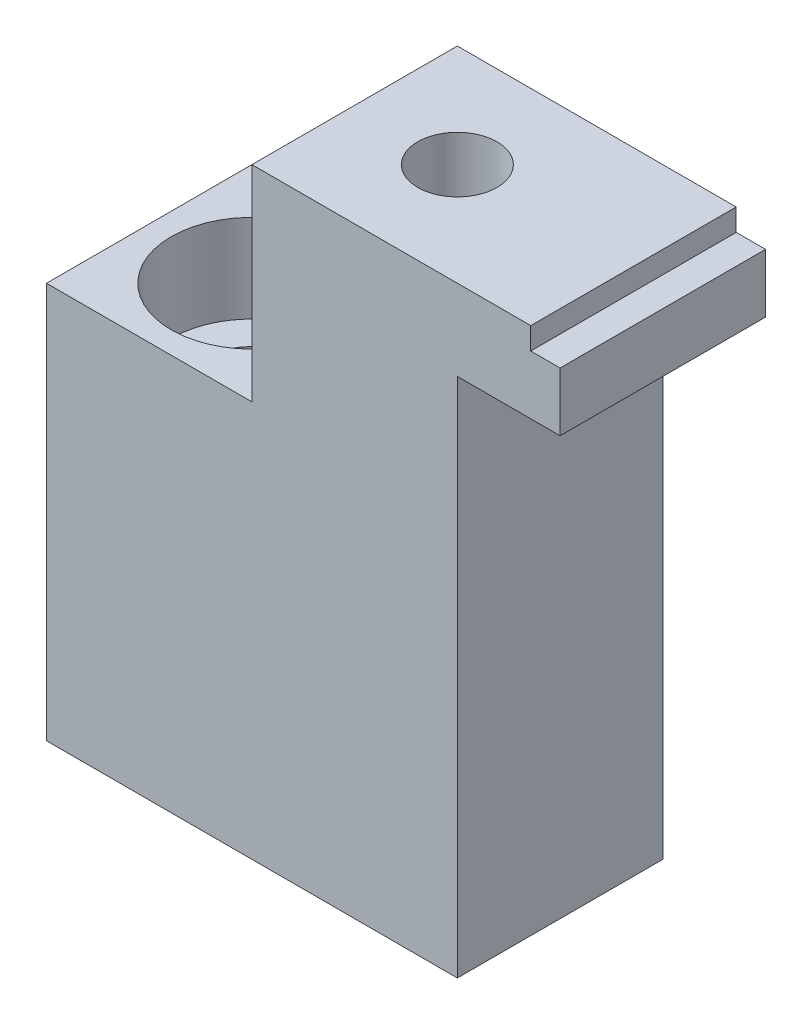
from build123d import *

# Parameters (mm, degrees)
SALIENTE_EXTRUIR1_DEPTH = 7
CROQUIS4_R              = 1.35
CORTAR_EXTRUIR1_DEPTH   = 13.5
CROQUIS5_R              = 1.6
CORTAR_EXTRUIR2_DEPTH   = 13.9
CROQUIS6_R              = 2.75
CORTAR_EXTRUIR3_DEPTH   = 3
CROQUIS7_W              = 11
CROQUIS7_H              = 7
CROQUIS7_R              = 1.6
SALIENTE_EXTRUIR2_DEPTH = 4


with BuildPart() as part:
    # Croquis1 → Saliente-Extruir1 (new body)
    with BuildSketch(Plane.XY):
        Polygon((0, 0), (4, 0), (4, -4), (7, -4), (7, 0), (7, 13.75), (10.5, 13.75), (10.5, 15.75), (9.5, 15.75), (9.5, 16.5), (7, 16.5), (0, 16.5), (0, 9.5), (-7, 9.5), (-7, 0), align=None)
    extrude(amount=SALIENTE_EXTRUIR1_DEPTH)

    # Croquis4 → Cortar-Extruir1 (cut)
    with BuildSketch(Plane(origin=(0, 16.5, 0), x_dir=(1, 0, 0), z_dir=(0, 1, 0))):
        with Locations(Location((3.5, -3.5, 0), (0, 0, 270))):
            Circle(CROQUIS4_R)
    extrude(amount=-CORTAR_EXTRUIR1_DEPTH, mode=Mode.SUBTRACT)

    # Croquis5 → Cortar-Extruir2 (cut)
    with BuildSketch(Plane(origin=(0, 9.5, 0), x_dir=(1, 0, 0), z_dir=(0, 1, 0))):
        with Locations(Location((-3.5, -3.5, 0), (0, 0, 180))):
            Circle(CROQUIS5_R)
    extrude(amount=-CORTAR_EXTRUIR2_DEPTH, mode=Mode.SUBTRACT)

    # Croquis6 → Cortar-Extruir3 (cut)
    with BuildSketch(Plane(origin=(0, 9.5, 0), x_dir=(1, 0, 0), z_dir=(0, 1, 0))):
        with Locations(Location((-3.5, -3.5, 0), (0, 0, 180))):
            Circle(CROQUIS6_R)
    extrude(amount=-CORTAR_EXTRUIR3_DEPTH, mode=Mode.SUBTRACT)

    # Croquis7 → Saliente-Extruir2 (add)
    with BuildSketch(Plane.XZ):
        with Locations((-1.5, 3.5)):
            Rectangle(CROQUIS7_W, CROQUIS7_H)
        with Locations(Location((-3.5, 3.5, 0), (0, 0, 180))):
            Circle(CROQUIS7_R, mode=Mode.SUBTRACT)
    extrude(amount=SALIENTE_EXTRUIR2_DEPTH)


solid = part.part
